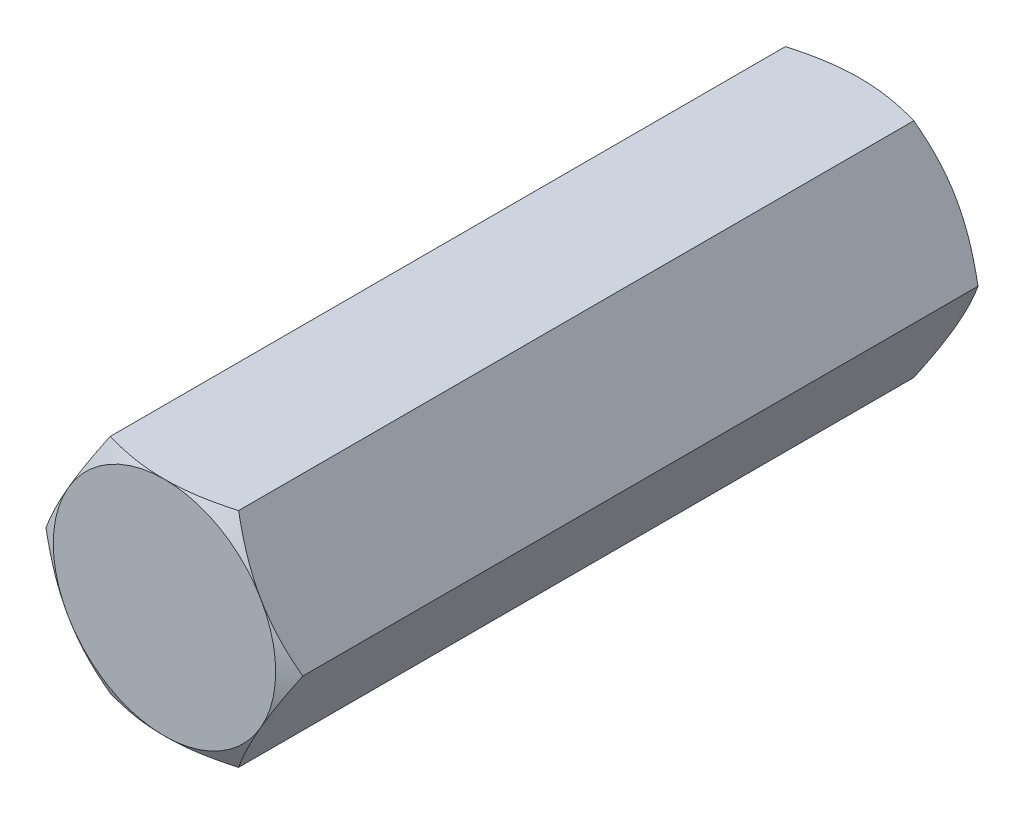
from build123d import *

# Parameters (mm, degrees)
BOSS_EXTRUDE1_DEPTH = 100


with BuildPart() as part:
    # Sketch1 → Boss-Extrude1 (new body)
    with BuildSketch(Plane.XY):
        Polygon((18.475208614, 0), (9.237604307, 16), (-9.237604307, 16), (-18.475208614, 0), (-9.237604307, -16), (9.237604307, -16), align=None)
    extrude(amount=BOSS_EXTRUDE1_DEPTH)

    # Sketch2 → Cut-Revolve1 (revolve, cut)
    with BuildSketch(Plane(origin=(0, 0, 0), x_dir=(0, 0, -1), z_dir=(1, 0, 0))):
        Polygon((-100, 16), (-100, 22.884653205), (-96.025143619, 22.884653205), align=None)
        Polygon((0, 22.884653205), (-3.974856381, 22.884653205), (0, 16), align=None)
    revolve(axis=Axis((0, 0, 0), (0, 0, 1)), mode=Mode.SUBTRACT)


solid = part.part
